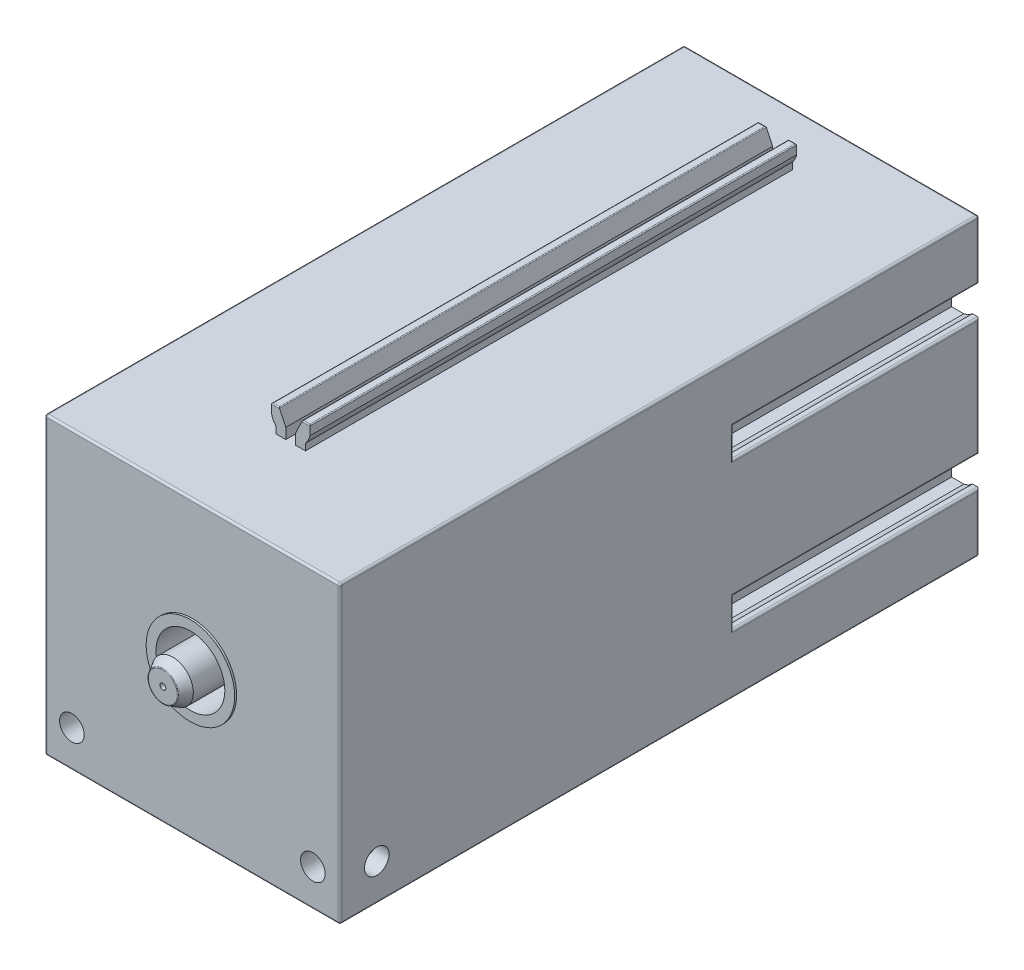
from build123d import *

# Parameters (mm, degrees)
SKETCH_1_W          = 30
SKETCH_1_H          = 30
EXTRUDE_1_DEPTH     = 65
CUT_EXTRUDE_1_DEPTH = 54
CUT_EXTRUDE_2_DEPTH = 25
EXTRUDE_START       = -5.5
EXTRUDE_2_DEPTH     = 49.5
FILLET_1_R          = 0.1
SKETCH_6_R          = 3.5
CUT_EXTRUDE_3_DEPTH = 5
EXTRUDE_START_2     = 0.2
SKETCH_7_R          = 4.5
SKETCH_7_R_2        = 3.5
EXTRUDE_3_DEPTH     = 0.2
SKETCH_8_R          = 2.1
EXTRUDE_4_DEPTH     = 8
SKETCH_9_R          = 0.3
CUT_EXTRUDE_4_DEPTH = 8
CHAMFER_1_SIZE      = 1
CHAMFER_1_SIZE2     = 0.577350269
FILLET_2_R          = 0.1
FILLET_3_R          = 0.2
SKETCH_10_R         = 1.25
CUT_EXTRUDE_5_DEPTH = 5
SKETCH_11_R         = 1.25
CUT_EXTRUDE_6_DEPTH = 5
CUT_EXTRUDE_START   = -5
SKETCH_12_R         = 1.25
CUT_EXTRUDE_7_DEPTH = 5


with BuildPart() as part:
    # 草图1 → 凸台-拉伸1 (new body)
    with BuildSketch(Plane.XY):
        with Locations((0, 15)):
            Rectangle(SKETCH_1_W, SKETCH_1_H)
    extrude(amount=-EXTRUDE_1_DEPTH)

    # 草图2 → 切除-拉伸1 (cut)
    with BuildSketch(Plane(origin=(0, 0, -65), x_dir=(-1, 0, 0), z_dir=(0, 0, -1))):
        with BuildLine():
            Line((-9, 0.677124344), (-9, 0))
            Line((-9, 0), (-6, 0))
            Line((-6, 0), (-6, 0.677124344))
            ThreePointArc((-6, 0.677124344), (-5.719957697, 1.088161527), (-5.55, 1.555590279))
            Line((-5.55, 1.555590279), (-5.55, 2.8))
            Line((-5.55, 2.8), (-9.45, 2.8))
            Line((-9.45, 2.8), (-9.45, 1.555590279))
            ThreePointArc((-9.45, 1.555590279), (-9.280042303, 1.088161527), (-9, 0.677124344))
        make_face()
        with BuildLine():
            Line((5.55, 2.8), (5.55, 1.555590279))
            ThreePointArc((5.55, 1.555590279), (5.719957697, 1.088161527), (6, 0.677124344))
            Line((6, 0.677124344), (6, 0))
            Line((6, 0), (9, 0))
            Line((9, 0), (9, 0.677124344))
            ThreePointArc((9, 0.677124344), (9.280042303, 1.088161527), (9.45, 1.555590279))
            Line((9.45, 1.555590279), (9.45, 2.8))
            Line((9.45, 2.8), (5.55, 2.8))
        make_face()
    extrude(amount=-CUT_EXTRUDE_1_DEPTH, mode=Mode.SUBTRACT)

    # 草图3 → 切除-拉伸2 (cut)
    with BuildSketch(Plane(origin=(0, 0, -65), x_dir=(-1, 0, 0), z_dir=(0, 0, -1))):
        with BuildLine():
            Line((-14.322875656, 9), (-15, 9))
            Line((-15, 9), (-15, 6))
            Line((-15, 6), (-14.322875656, 6))
            ThreePointArc((-14.322875656, 6), (-13.911838473, 5.719957697), (-13.444409721, 5.55))
            Line((-13.444409721, 5.55), (-12.2, 5.55))
            Line((-12.2, 5.55), (-12.2, 9.45))
            Line((-12.2, 9.45), (-13.444409721, 9.45))
            ThreePointArc((-13.444409721, 9.45), (-13.911838473, 9.280042303), (-14.322875656, 9))
        make_face()
        with BuildLine():
            Line((-12.2, 20.55), (-13.444409721, 20.55))
            ThreePointArc((-13.444409721, 20.55), (-13.911838473, 20.719957697), (-14.322875656, 21))
            Line((-14.322875656, 21), (-15, 21))
            Line((-15, 21), (-15, 24))
            Line((-15, 24), (-14.322875656, 24))
            ThreePointArc((-14.322875656, 24), (-13.911838473, 24.280042303), (-13.444409721, 24.45))
            Line((-13.444409721, 24.45), (-12.2, 24.45))
            Line((-12.2, 24.45), (-12.2, 20.55))
        make_face()
        with BuildLine():
            Line((14.322875656, 21), (15, 21))
            Line((15, 21), (15, 24))
            Line((15, 24), (14.322875656, 24))
            ThreePointArc((14.322875656, 24), (13.911838473, 24.280042303), (13.444409721, 24.45))
            Line((13.444409721, 24.45), (12.2, 24.45))
            Line((12.2, 24.45), (12.2, 20.55))
            Line((12.2, 20.55), (13.444409721, 20.55))
            ThreePointArc((13.444409721, 20.55), (13.911838473, 20.719957697), (14.322875656, 21))
        make_face()
        with BuildLine():
            Line((12.2, 9.45), (13.444409721, 9.45))
            ThreePointArc((13.444409721, 9.45), (13.911838473, 9.280042303), (14.322875656, 9))
            Line((14.322875656, 9), (15, 9))
            Line((15, 9), (15, 6))
            Line((15, 6), (14.322875656, 6))
            ThreePointArc((14.322875656, 6), (13.911838473, 5.719957697), (13.444409721, 5.55))
            Line((13.444409721, 5.55), (12.2, 5.55))
            Line((12.2, 5.55), (12.2, 9.45))
        make_face()
    extrude(amount=-CUT_EXTRUDE_2_DEPTH, mode=Mode.SUBTRACT)

    # 草图5 → 凸台-拉伸2 (add)
    with BuildSketch(Plane(origin=(0, 0, -65), x_dir=(-1, 0, 0), z_dir=(0, 0, -1)).offset(EXTRUDE_START)):
        with BuildLine():
            Line((-1.5, 30.677124344), (-1.5, 30))
            Line((-1.5, 30), (-0.5, 30))
            Line((-0.5, 30), (-0.5, 31.07225346))
            Line((-0.5, 31.07225346), (-1.165769145, 32.5))
            Line((-1.165769145, 32.5), (-1.95, 32.5))
            Line((-1.95, 32.5), (-1.95, 31.555590279))
            ThreePointArc((-1.95, 31.555590279), (-1.780042303, 31.088161527), (-1.5, 30.677124344))
        make_face()
        with BuildLine():
            Line((1.5, 30), (1.5, 30.677124344))
            ThreePointArc((1.5, 30.677124344), (1.780042303, 31.088161527), (1.95, 31.555590279))
            Line((1.95, 31.555590279), (1.95, 32.5))
            Line((1.95, 32.5), (1.165769145, 32.5))
            Line((1.165769145, 32.5), (0.5, 31.07225346))
            Line((0.5, 31.07225346), (0.5, 30))
            Line((0.5, 30), (1.5, 30))
        make_face()
    extrude(amount=-EXTRUDE_2_DEPTH)

    # 圆角1
    fillet_1_edges = [part.edges().sort_by_distance(p)[0] for p in [
        (1.557884573, 32.5, -10),
        (1.95, 32.5, -34.75),
        (1.165769145, 32.5, -34.75),
        (1.557884573, 32.5, -59.5),
        (-1.557884573, 32.5, -10),
        (-1.165769145, 32.5, -34.75),
        (-1.95, 32.5, -34.75),
        (-1.557884573, 32.5, -59.5),
    ]]
    fillet(fillet_1_edges, radius=FILLET_1_R)

    # 草图6 → 切除-拉伸3 (cut)
    with BuildSketch(Plane.XY):
        with Locations((0, 15)):
            Circle(SKETCH_6_R)
    extrude(amount=-CUT_EXTRUDE_3_DEPTH, mode=Mode.SUBTRACT)

    # 草图7 → 凸台-拉伸3 (add)
    with BuildSketch(Plane.XY.offset(EXTRUDE_START_2)):
        with Locations(Location((0, 15, 0), (0, 0, 180))):
            Circle(SKETCH_7_R)
        with Locations((0, 15)):
            Circle(SKETCH_7_R_2, mode=Mode.SUBTRACT)
    extrude(amount=-EXTRUDE_3_DEPTH)

    # 草图8 → 凸台-拉伸4 (add)
    with BuildSketch(Plane.XY.offset(-5)):
        with Locations((0, 15)):
            Circle(SKETCH_8_R)
    extrude(amount=EXTRUDE_4_DEPTH)

    # 草图9 → 切除-拉伸4 (cut)
    with BuildSketch(Plane.XY.offset(3)):
        with Locations((0, 15)):
            Circle(SKETCH_9_R)
    extrude(amount=-CUT_EXTRUDE_4_DEPTH, mode=Mode.SUBTRACT)

    # 倒角1
    chamfer_1_edges = [part.edges().sort_by_distance(p)[0] for p in [
        (-2.1, 15, 3),
    ]]
    chamfer_1_side = [part.faces().sort_by_distance(p)[0] for p in [
        (-2.1, 15, -1),
    ]]
    chamfer(chamfer_1_edges, length=CHAMFER_1_SIZE, length2=CHAMFER_1_SIZE2, reference=chamfer_1_side[0])

    # 圆角2
    fillet_2_edges = [part.edges().sort_by_distance(p)[0] for p in [
        (-1.522649731, 15, 3),
    ]]
    fillet(fillet_2_edges, radius=FILLET_2_R)

    # 圆角3
    fillet_3_edges = [part.edges().sort_by_distance(p)[0] for p in [
        (15, 3, -65),
        (-15, 15, -65),
        (-15, 22.5, -40),
        (-15, 24, -52.5),
        (-15, 21, -52.5),
        (-15, 3, -65),
        (0, 30, -65),
        (-15, 7.5, -40),
        (-15, 9, -52.5),
        (-15, 6, -52.5),
        (12, 0, -65),
        (7.5, 0, -11),
        (6, 0, -38),
        (9, 0, -38),
        (0, 0, -65),
        (-15, 27, -65),
        (-7.5, 0, -11),
        (-9, 0, -38),
        (-6, 0, -38),
        (0, 30, 0),
        (15, 15, 0),
        (0, 0, 0),
        (-15, 15, 0),
        (15, 15, -65),
        (-12, 0, -65),
        (15, 7.5, -40),
        (15, 6, -52.5),
        (15, 9, -52.5),
        (-15, 30, -32.5),
        (15, 30, -32.5),
        (15, 0, -32.5),
        (-15, 0, -32.5),
        (15, 27, -65),
        (15, 22.5, -40),
        (15, 21, -52.5),
        (15, 24, -52.5),
    ]]
    fillet(fillet_3_edges, radius=FILLET_3_R)

    # 草图10 → 切除-拉伸5 (cut)
    with BuildSketch(Plane.XY):
        with Locations((-12.25, 3.75)):
            Circle(SKETCH_10_R)
        with Locations((12.25, 3.75)):
            Circle(SKETCH_10_R)
    extrude(amount=-CUT_EXTRUDE_5_DEPTH, mode=Mode.SUBTRACT)

    # 草图11 → 切除-拉伸6 (cut)
    with BuildSketch(Plane(origin=(15, 0, 0), x_dir=(0, 0, -1), z_dir=(1, 0, 0))):
        with Locations((3.75, 3.75)):
            Circle(SKETCH_11_R)
    extrude(amount=-CUT_EXTRUDE_6_DEPTH, mode=Mode.SUBTRACT)

    # 草图12 → 切除-拉伸7 (cut)
    with BuildSketch(Plane.ZY.offset(15).offset(CUT_EXTRUDE_START)):
        with Locations(Location((-3.75, 3.75, 0), (0, 0, 180))):
            Circle(SKETCH_12_R)
    extrude(amount=CUT_EXTRUDE_7_DEPTH, mode=Mode.SUBTRACT)


solid = part.part
